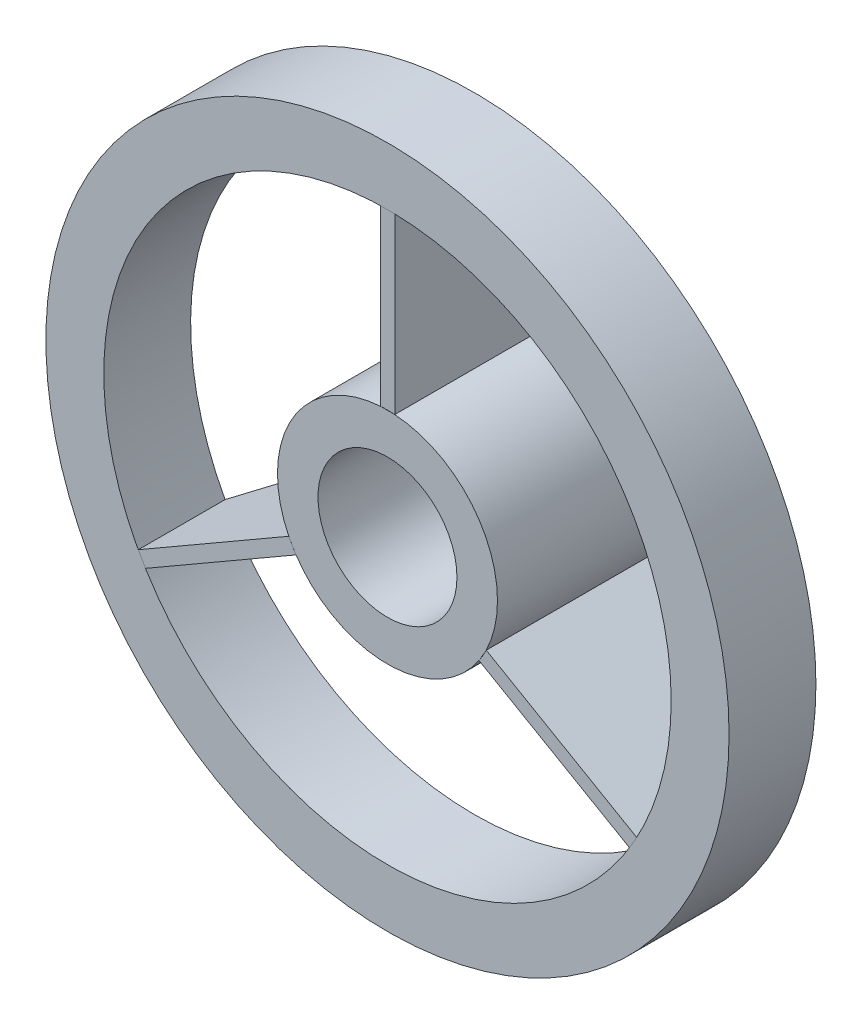
from build123d import *

# Parameters (mm, degrees)
SKETCH1_R           = 1.9
SKETCH1_R_2         = 1.2
BOSS_EXTRUDE1_DEPTH = 3.5
SKETCH2_R           = 5.9
SKETCH2_R_2         = 4.9
BOSS_EXTRUDE2_DEPTH = 1.5
BOSS_EXTRUDE3_DEPTH = 0.125
CIRPATTERN1_COUNT   = 3


with BuildPart() as part:
    # Sketch1 → Boss-Extrude1 (new body)
    with BuildSketch(Plane.XY):
        Circle(SKETCH1_R)
        Circle(SKETCH1_R_2, mode=Mode.SUBTRACT)
    extrude(amount=BOSS_EXTRUDE1_DEPTH)



with BuildPart() as body_2:
    # Sketch2 → Boss-Extrude2 (new body)
    with BuildSketch(Plane.XY.offset(3.5)):
        Circle(SKETCH2_R)
        Circle(SKETCH2_R_2, mode=Mode.SUBTRACT)
    extrude(amount=-BOSS_EXTRUDE2_DEPTH)


with BuildPart() as part_1:
    add(part.part)

    add(body_2.part)  # Boss-Extrude3 merges body 2
    # Sketch7 → Boss-Extrude3 (add, symmetric)
    with BuildSketch(Plane(origin=(0, 0, 0), x_dir=(0, 0, -1), z_dir=(1, 0, 0))):
        Polygon((-3.498505426, 1.898798754), (-3.498505426, 4.906659039), (-2.003497041, 4.906659039), (0, 1.898798754), (0, 1.698798754), (-3.498505426, 1.698798754), align=None)
    boss_extrude3 = extrude(amount=BOSS_EXTRUDE3_DEPTH, both=True)

    # CirPattern1: Boss-Extrude3 ×3 about axis
    cirpattern1_axis = Axis((0, 0, 3.5), (0, 0, -1))
    for i in range(1, CIRPATTERN1_COUNT):
        add(boss_extrude3.rotate(cirpattern1_axis, i * 360 / CIRPATTERN1_COUNT))


solid = part_1.part
